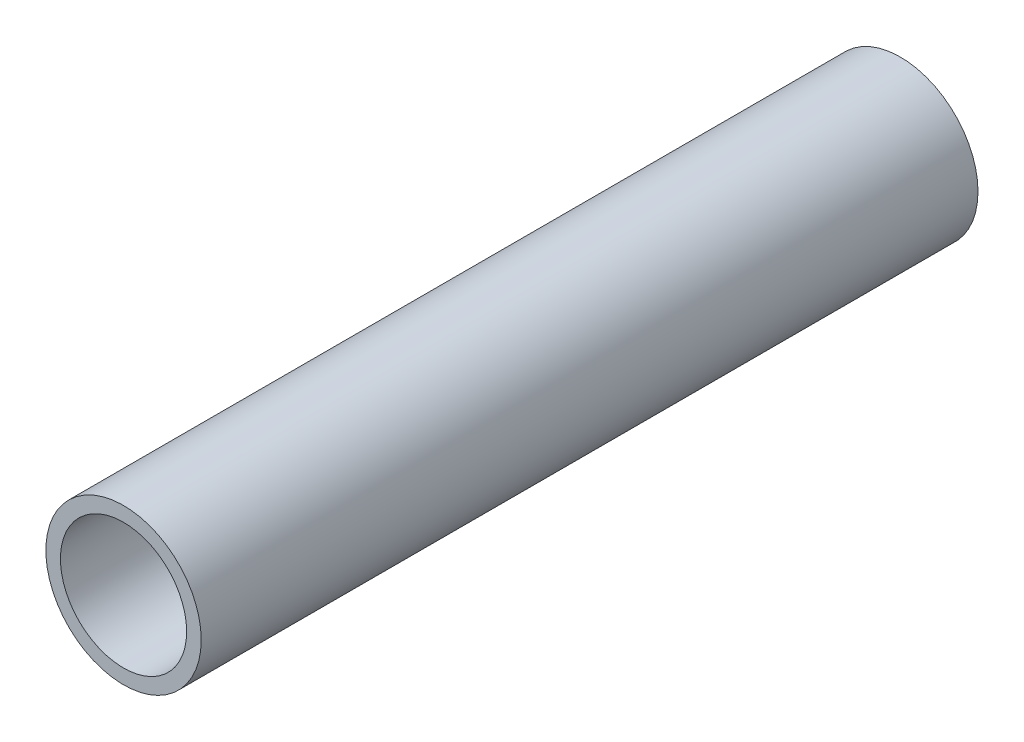
from build123d import *

# Parameters (mm, degrees)
CROQUIS1_R     = 16
EXTRUIR1_DEPTH = 80
VACIADO1_T     = -3


with BuildPart() as part:
    # Croquis1 → Extruir1 (new, symmetric)
    with BuildSketch(Plane.XY):
        Circle(CROQUIS1_R)
    extrude(amount=EXTRUIR1_DEPTH, both=True)

    # Vaciado1
    vaciado1_openings = [part.faces().sort_by_distance(p)[0] for p in [
        (0, 0, 80),
        (0, 0, -80),
    ]]
    offset(amount=VACIADO1_T, openings=vaciado1_openings, kind=Kind.INTERSECTION)


solid = part.part
